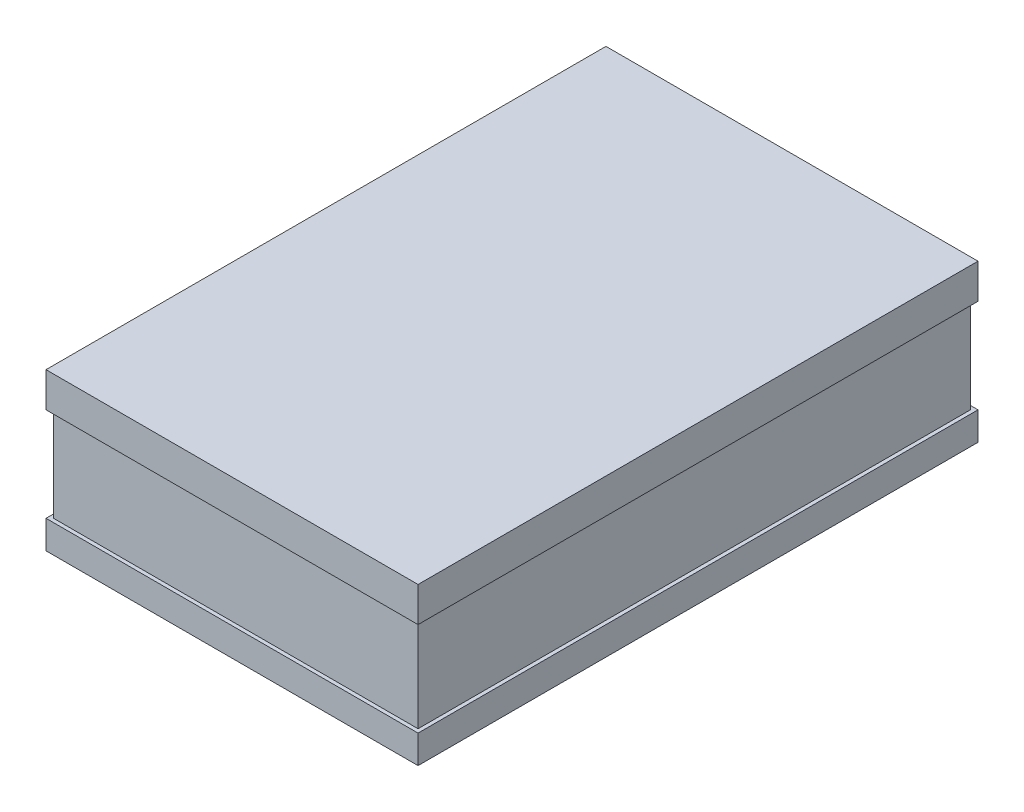
from build123d import *

# Parameters (mm, degrees)
SKETCH_1_W          = 198
SKETCH_1_H          = 298
SKETCH_1_W_2        = 175
SKETCH_1_H_2        = 275
EXTRUDE_1_DEPTH     = 80
SKETCH_2_W          = 198
SKETCH_2_H          = 298
EXTRUDE_2_DEPTH     = 3.5
SKETCH_3_W          = 200
SKETCH_3_H          = 300
SKETCH_3_W_2        = 194
SKETCH_3_H_2        = 294
CUT_EXTRUDE_1_DEPTH = 25


with BuildPart() as part:
    # 草图1 → 凸台-拉伸1 (new body)
    with BuildSketch(Plane(origin=(0, 0, 0), x_dir=(1, 0, 0), z_dir=(0, 1, 0))):
        Rectangle(SKETCH_1_W, SKETCH_1_H)
        Rectangle(SKETCH_1_W_2, SKETCH_1_H_2, mode=Mode.SUBTRACT)
    extrude(amount=-EXTRUDE_1_DEPTH)

    # 草图2 → 凸台-拉伸2 (add)
    with BuildSketch(Plane(origin=(0, 0, 0), x_dir=(1, 0, 0), z_dir=(0, 1, 0))):
        Rectangle(SKETCH_2_W, SKETCH_2_H)
    extrude(amount=EXTRUDE_2_DEPTH)

    # 草图3 → 切除-拉伸1 (cut, symmetric)
    with BuildSketch(Plane(origin=(0, -40, 0), x_dir=(-1, 0, 0), z_dir=(0, -1, 0))):
        Rectangle(SKETCH_3_W, SKETCH_3_H)
        Rectangle(SKETCH_3_W_2, SKETCH_3_H_2, mode=Mode.SUBTRACT)
    extrude(amount=CUT_EXTRUDE_1_DEPTH, both=True, mode=Mode.SUBTRACT)


solid = part.part
